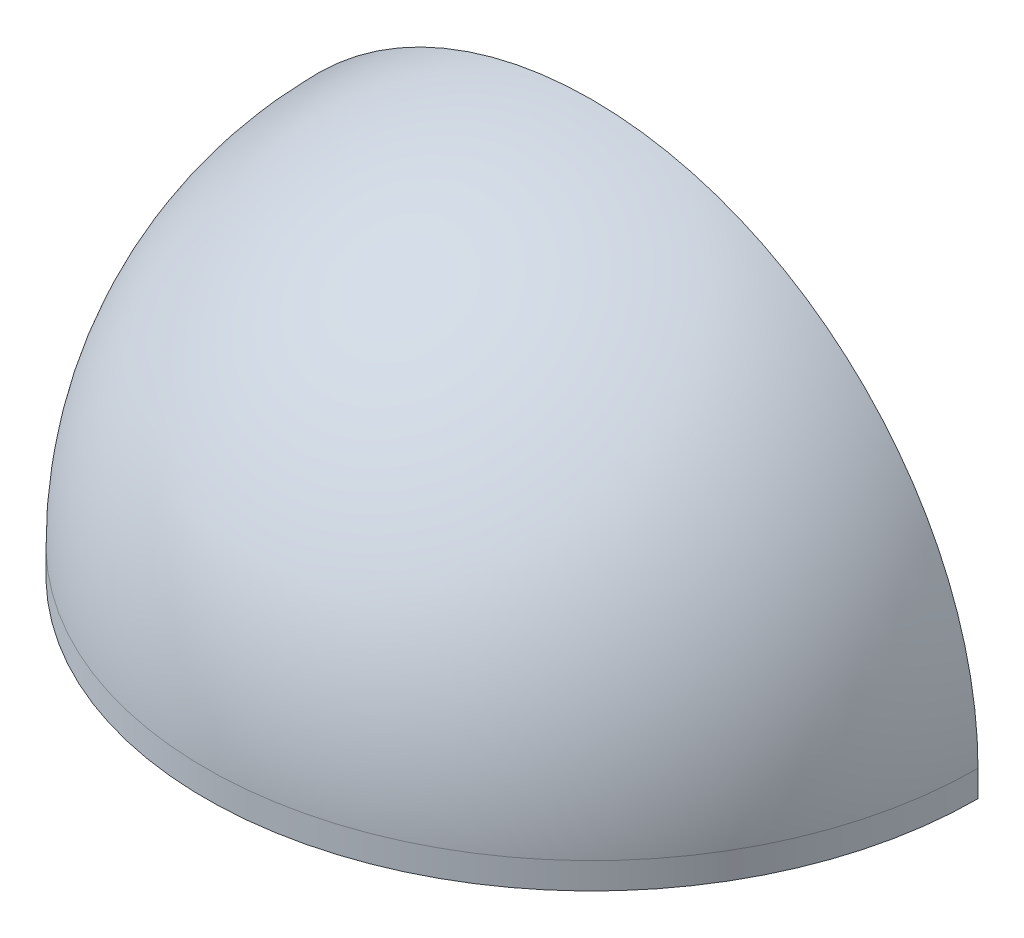
from build123d import *

# Parameters (mm, degrees)
REVOLUCI_N1_ANGLE     = 180
CROQUIS2_W            = 2
CROQUIS2_H            = 3
CORTAR_EXTRUIR1_DEPTH = 20
CORTAR_EXTRUIR2_DEPTH = 8.865505


with BuildPart() as part:
    # Croquis1 → Revolución1 (revolve)
    with BuildSketch(Plane.XY):
        with BuildLine():
            Line((-49.782166939, -2.382597623), (-32.714919408, -2.382597623))
            Line((-32.714919408, -2.382597623), (-32.714919408, -12.382597623))
            Line((-32.714919408, -12.382597623), (-31.082166939, -12.382597623))
            Line((-31.082166939, -12.382597623), (-31.082166939, -17.382597623))
            Line((-31.082166939, -17.382597623), (-34.282166939, -12.382597623))
            Line((-34.282166939, -12.382597623), (-37.282166939, -12.382597623))
            Line((-37.282166939, -12.382597623), (-37.282166939, -3.882597623))
            Line((-37.282166939, -3.882597623), (-38.282166939, -3.882597623))
            Line((-38.282166939, -3.882597623), (-41.282166939, -3.882597623))
            Line((-41.282166939, -3.882597623), (-51.282166939, -3.882597623))
            Line((-51.282166939, -3.882597623), (-51.282166939, -2.382597623))
            ThreePointArc((-51.282166939, -2.382597623), (-44.838516125, 13.173751563), (-29.282166939, 19.617402377))
            Line((-29.282166939, 19.617402377), (-29.282166939, 18.117402377))
            ThreePointArc((-29.282166939, 18.117402377), (-43.777855954, 12.113091391), (-49.782166939, -2.382597623))
        make_face()
    revolve(axis=Axis((-29.282166939, 18.117402377, 0), (0, 1, 0)), revolution_arc=REVOLUCI_N1_ANGLE)

    # Croquis2 → Cortar-Extruir1 (cut)
    with BuildSketch(Plane(origin=(0, 0, 0), x_dir=(-1, 0, 0), z_dir=(0, 0, -1))):
        with Locations((34.714919408, -9.882597623)):
            Rectangle(CROQUIS2_W, CROQUIS2_H)
        with Locations((34.714919408, -5.882597623)):
            Rectangle(CROQUIS2_W, CROQUIS2_H)
        with Locations((23.84941447, -9.882597623)):
            Rectangle(CROQUIS2_W, CROQUIS2_H)
        with Locations((23.84941447, -5.882597623)):
            Rectangle(CROQUIS2_W, CROQUIS2_H)
    extrude(amount=-CORTAR_EXTRUIR1_DEPTH, mode=Mode.SUBTRACT)

    # Croquis3 → Cortar-Extruir2 (cut)
    with BuildSketch(Plane.ZY.offset(33.714919408)):
        Polygon((6.659632539, -7.382597623), (4.659632539, -7.382597623), (4.659632539, -4.382597623), (9.659632539, -4.382597623), (9.659632539, -7.382597623), align=None)
        Polygon((6.659632539, -11.382597623), (4.659632539, -11.382597623), (4.659632539, -8.382597623), (9.659632539, -8.382597623), (9.659632539, -11.382597623), align=None)
    extrude(amount=-CORTAR_EXTRUIR2_DEPTH, mode=Mode.SUBTRACT)


solid = part.part
